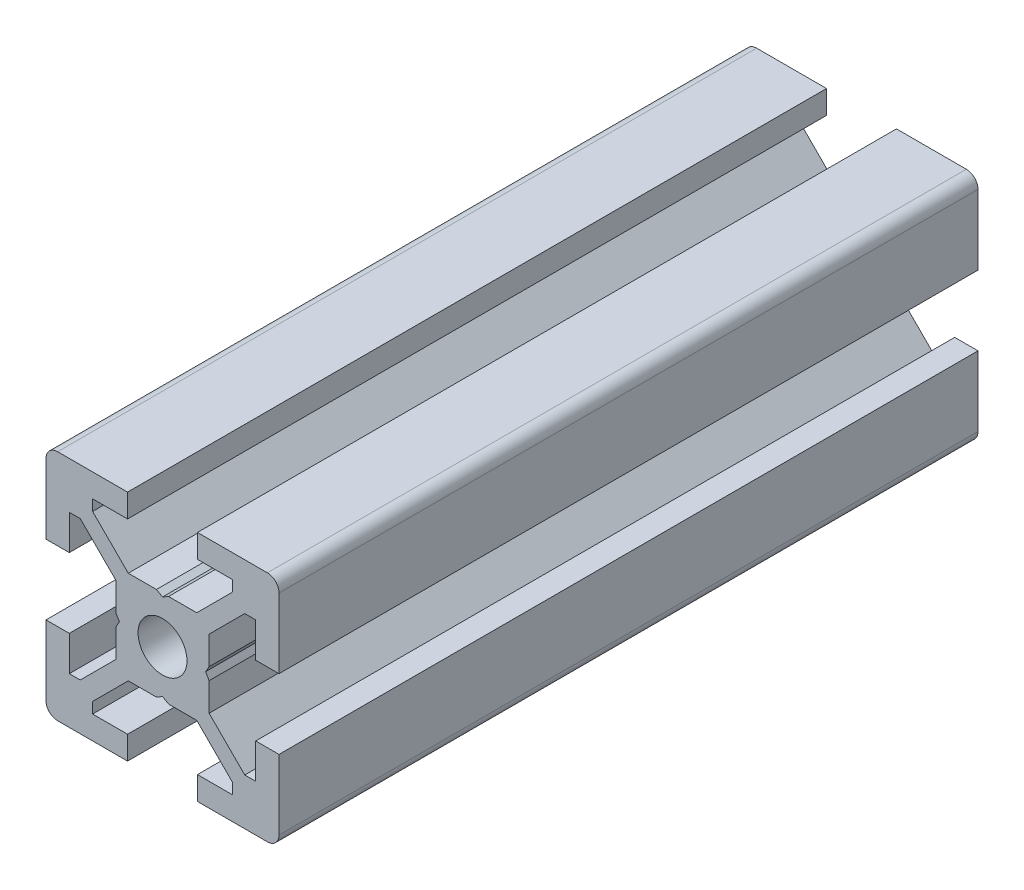
from build123d import *

# Parameters (mm, degrees)
BOSS_EXTRUDE1_DEPTH = 60
SKETCH2_W           = 60
SKETCH2_H           = 2.1


with BuildPart() as part:
    # Sketch1 → Boss-Extrude1 (new body)
    with BuildSketch(Plane.XY):
        with BuildLine():
            Line((-10, -3), (-10, -9))
            ThreePointArc((-10, -9), (-9.707106781, -9.707106781), (-9, -10))
            Line((-9, -10), (-3, -10))
            Line((-3, -10), (-3, -8))
            Line((-3, -8), (-6, -8))
            Line((-6, -8), (-6, -7.060660172))
            Line((-6, -7.060660172), (-2.939339828, -4))
            Line((-2.939339828, -4), (-0.519615242, -4))
            Line((-0.519615242, -4), (0, -3.7))
            Line((0, -3.7), (0.519615242, -4))
            Line((0.519615242, -4), (2.939339828, -4))
            Line((2.939339828, -4), (6, -7.060660172))
            Line((6, -7.060660172), (6, -8))
            Line((6, -8), (3, -8))
            Line((3, -8), (3, -10))
            Line((3, -10), (9, -10))
            ThreePointArc((9, -10), (9.707106781, -9.707106781), (10, -9))
            Line((10, -9), (10, -3))
            Line((10, -3), (8, -3))
            Line((8, -3), (8, -6))
            Line((8, -6), (7.060660172, -6))
            Line((7.060660172, -6), (4, -2.939339828))
            Line((4, -2.939339828), (4, -0.519615242))
            Line((4, -0.519615242), (3.7, 0))
            Line((3.7, 0), (4, 0.519615242))
            Line((4, 0.519615242), (4, 2.939339828))
            Line((4, 2.939339828), (7.060660172, 6))
            Line((7.060660172, 6), (8, 6))
            Line((8, 6), (8, 3))
            Line((8, 3), (10, 3))
            Line((10, 3), (10, 9))
            ThreePointArc((10, 9), (9.707106781, 9.707106781), (9, 10))
            Line((9, 10), (3, 10))
            Line((3, 10), (3, 8))
            Line((3, 8), (6, 8))
            Line((6, 8), (6, 7.060660172))
            Line((6, 7.060660172), (2.939339828, 4))
            Line((2.939339828, 4), (0.519615242, 4))
            Line((0.519615242, 4), (0, 3.7))
            Line((0, 3.7), (-0.519615242, 4))
            Line((-0.519615242, 4), (-2.939339828, 4))
            Line((-2.939339828, 4), (-6, 7.060660172))
            Line((-6, 7.060660172), (-6, 8))
            Line((-6, 8), (-3, 8))
            Line((-3, 8), (-3, 10))
            Line((-3, 10), (-9, 10))
            ThreePointArc((-9, 10), (-9.707106781, 9.707106781), (-10, 9))
            Line((-10, 9), (-10, 3))
            Line((-10, 3), (-8, 3))
            Line((-8, 3), (-8, 6))
            Line((-8, 6), (-7.060660172, 6))
            Line((-7.060660172, 6), (-4, 2.939339828))
            Line((-4, 2.939339828), (-4, 0.519615242))
            Line((-4, 0.519615242), (-3.7, 0))
            Line((-3.7, 0), (-4, -0.519615242))
            Line((-4, -0.519615242), (-4, -2.939339828))
            Line((-4, -2.939339828), (-7.060660172, -6))
            Line((-7.060660172, -6), (-8, -6))
            Line((-8, -6), (-8, -3))
            Line((-8, -3), (-10, -3))
        make_face()
    extrude(amount=-BOSS_EXTRUDE1_DEPTH)

    # Sketch2 → Cut-Revolve1 (revolve, cut)
    with BuildSketch(Plane(origin=(0, 0, 0), x_dir=(0, 0, -1), z_dir=(1, 0, 0)), mode=Mode.PRIVATE) as cut_revolve1_sk:
        with Locations((30, 1.05)):
            Rectangle(SKETCH2_W, SKETCH2_H)
    revolve(cut_revolve1_sk.sketch.rotate(Axis((0, 0, -60), (0, 0, 1)), 270), axis=Axis((0, 0, -60), (0, 0, 1)), mode=Mode.SUBTRACT)


solid = part.part
